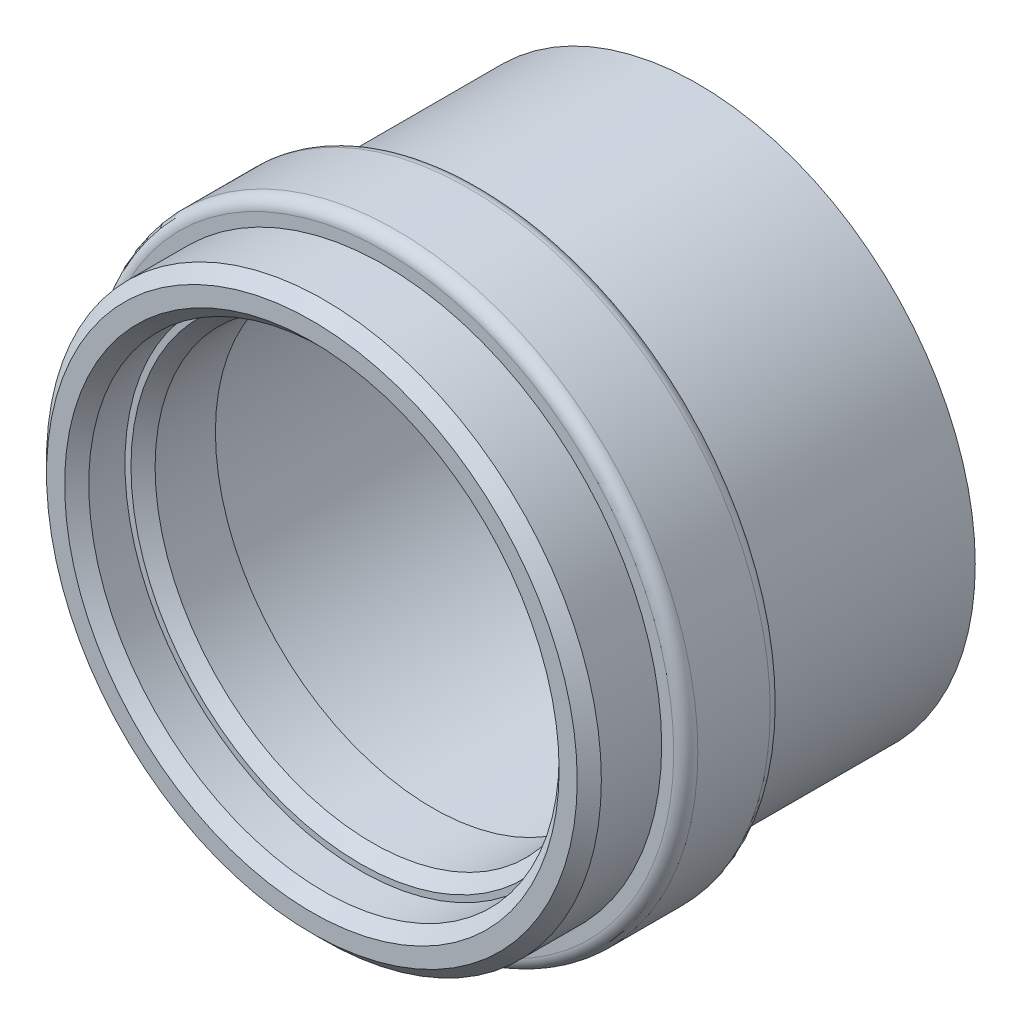
from build123d import *

# Parameters (mm, degrees)
SKETCH_1_R          = 11.5
EXTRUDE_1_DEPTH     = 16
EXTRUDE_START       = -3
SKETCH_2_R          = 12.5
EXTRUDE_2_DEPTH     = 4
SKETCH_3_R          = 9.75
CUT_EXTRUDE_1_DEPTH = 2
SKETCH_4_R          = 9
CUT_EXTRUDE_2_DEPTH = 23.549944568
SKETCH_5_R          = 10
CUT_EXTRUDE_3_DEPTH = 11
CHAMFER_1_SIZE      = 0.5
FILLET_1_R          = 0.5


with BuildPart() as part:
    # 草图1 → 凸台-拉伸1 (new body)
    with BuildSketch(Plane.XY):
        Circle(SKETCH_1_R)
    extrude(amount=EXTRUDE_1_DEPTH)

    # 草图2 → 凸台-拉伸2 (add)
    with BuildSketch(Plane.XY.offset(16).offset(EXTRUDE_START)):
        Circle(SKETCH_2_R)
    extrude(amount=-EXTRUDE_2_DEPTH)

    # 草图3 → 切除-拉伸1 (cut)
    with BuildSketch(Plane.XY.offset(16)):
        Circle(SKETCH_3_R)
    extrude(amount=-CUT_EXTRUDE_1_DEPTH, mode=Mode.SUBTRACT)

    # 草图4 → 切除-拉伸2 (cut, through all)
    with BuildSketch(Plane.XY.offset(14)):
        Circle(SKETCH_4_R)
    extrude(amount=-CUT_EXTRUDE_2_DEPTH, mode=Mode.SUBTRACT)

    # 草图5 → 切除-拉伸3 (cut)
    with BuildSketch(Plane(origin=(0, 0, 0), x_dir=(-1, 0, 0), z_dir=(0, 0, -1))):
        Circle(SKETCH_5_R)
    extrude(amount=-CUT_EXTRUDE_3_DEPTH, mode=Mode.SUBTRACT)

    # 倒角1
    chamfer_1_edges = [part.edges().sort_by_distance(p)[0] for p in [
        (-9.75, 0, 16),
        (-9, 0, 14),
        (10, 0, 0),
        (-11.5, 0, 16),
    ]]
    chamfer(chamfer_1_edges, length=CHAMFER_1_SIZE)

    # 圆角1
    fillet_1_edges = [part.edges().sort_by_distance(p)[0] for p in [
        (-12.5, 0, 9),
        (-12.5, 0, 13),
    ]]
    fillet(fillet_1_edges, radius=FILLET_1_R)


solid = part.part
